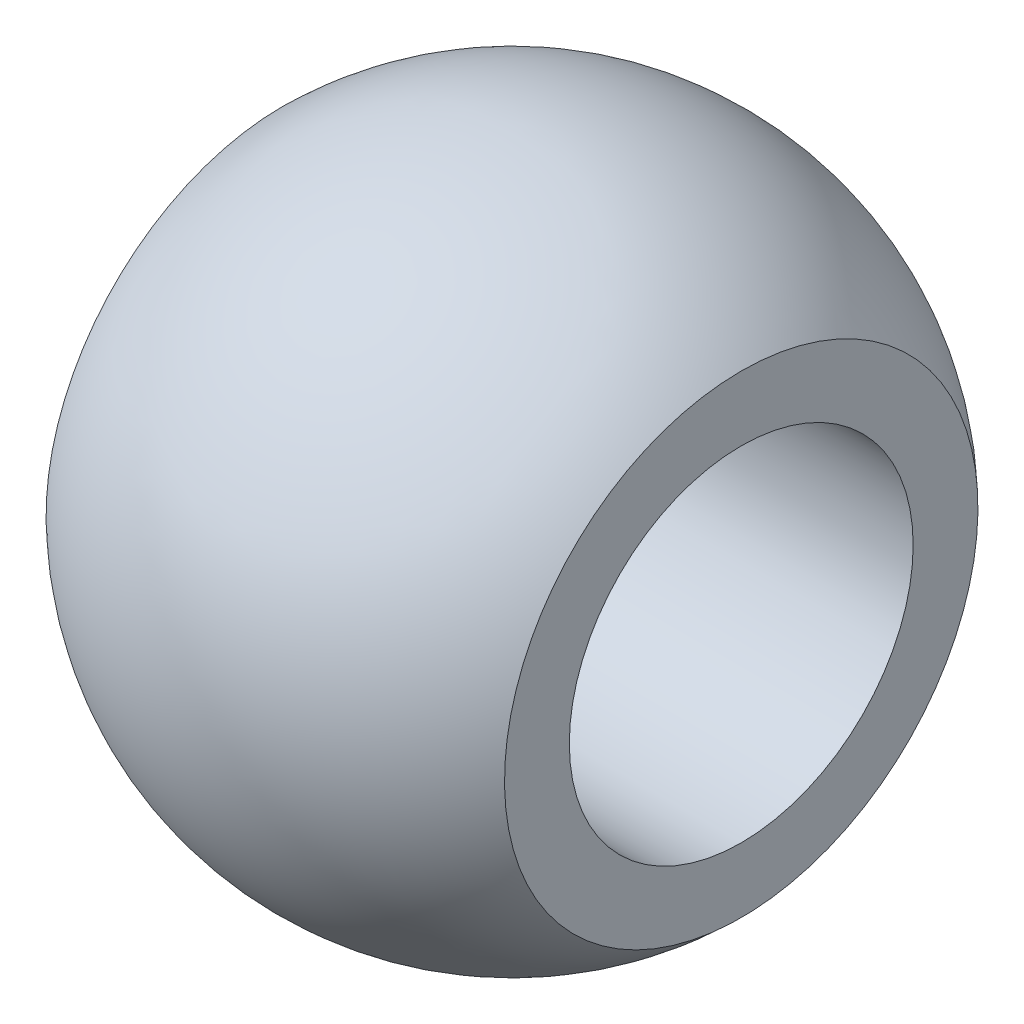
from build123d import *


with BuildPart() as part:
    # Sketch1 → Revolve1 (revolve)
    with BuildSketch(Plane.XY):
        with BuildLine():
            Line((-6.35, 6.557451183), (-6.35, 4.7625))
            Line((-6.35, 4.7625), (6.35, 4.7625))
            Line((6.35, 4.7625), (6.35, 6.557451183))
            ThreePointArc((6.35, 6.557451183), (0, 9.128125), (-6.35, 6.557451183))
        make_face()
    revolve(axis=Axis((-9.128125, 0, 0), (1, 0, 0)))


solid = part.part
